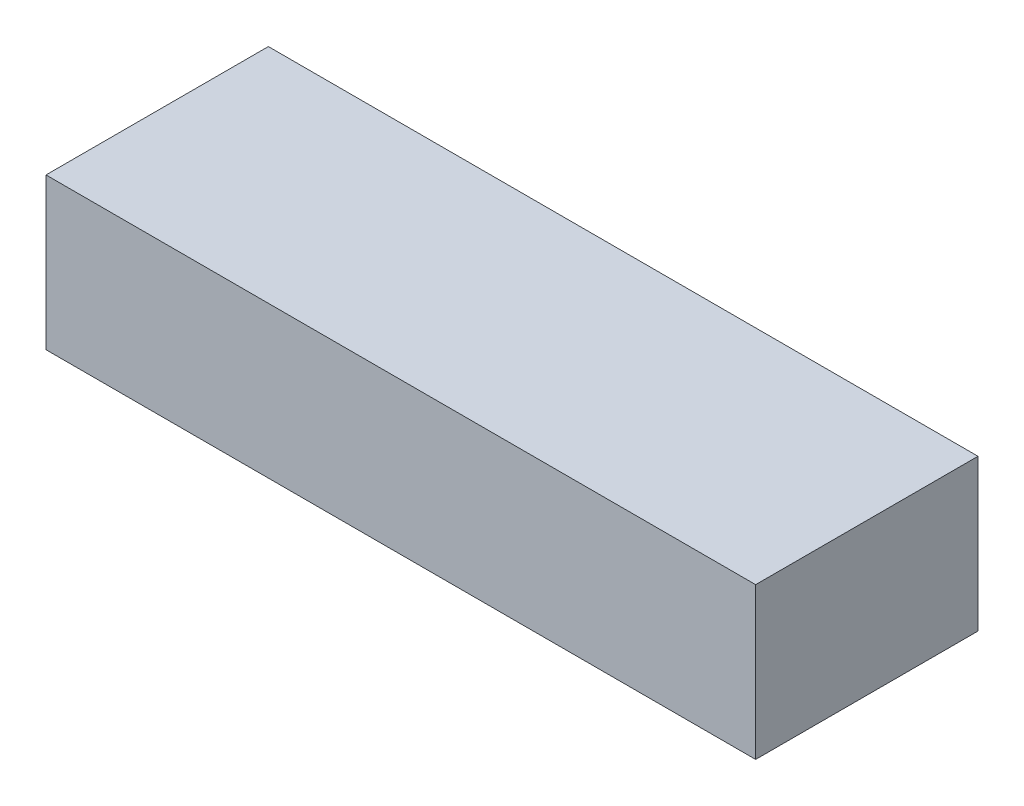
from build123d import *

# Parameters (mm, degrees)
SKETCH1_W           = 150
SKETCH1_H           = 47
BOSS_EXTRUDE1_DEPTH = 32


with BuildPart() as part:
    # Sketch1 → Boss-Extrude1 (new body)
    with BuildSketch(Plane(origin=(0, 0, 0), x_dir=(1, 0, 0), z_dir=(0, 1, 0))):
        with Locations((75, 23.5)):
            Rectangle(SKETCH1_W, SKETCH1_H)
    extrude(amount=BOSS_EXTRUDE1_DEPTH)


solid = part.part
